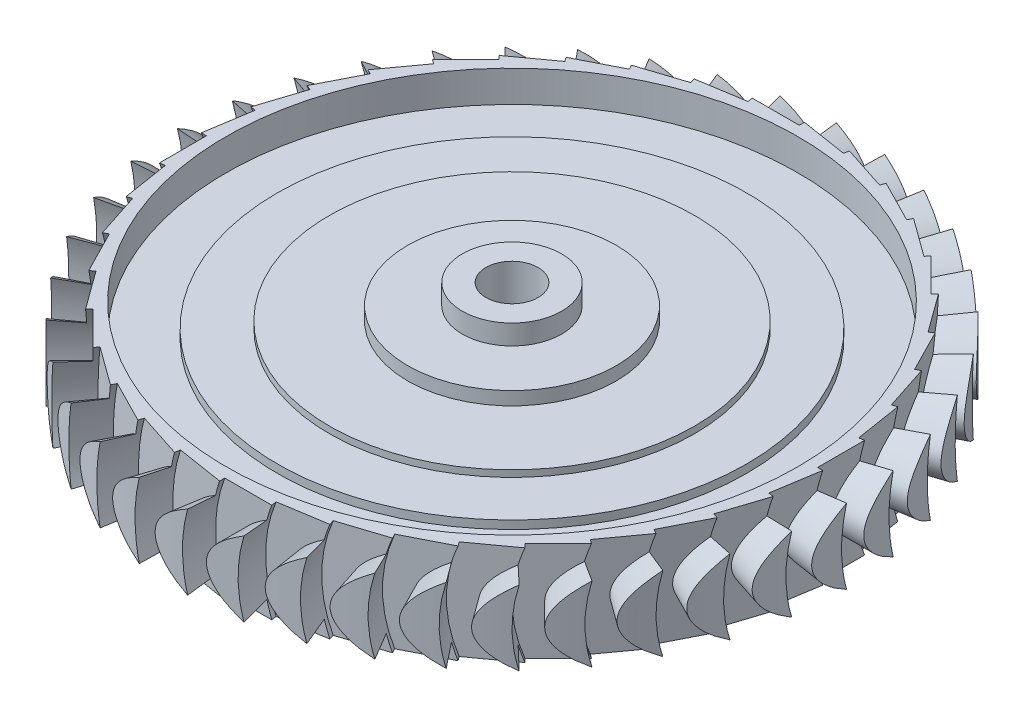
from build123d import *

# Parameters (mm, degrees)
BLADE_CUT_DEPTH   = 6.35
CIRPATTERN1_COUNT = 40


with BuildPart() as part:
    # Sketch3 → Revolve1 (revolve)
    with BuildSketch(Plane.XY):
        Polygon((63.175, -9.525), (63.175, 9.525), (56.825, 9.525), (54.825, 9.525), (54.825, 3.5), (45, 3.5), (45, 5.08), (35, 5.08), (35, 6.35), (20, 6.35), (20, 8.89), (9.525, 8.89), (9.525, 12.7), (5, 12.7), (5, -12.7), (9.525, -12.7), (9.525, -8.89), (20, -8.89), (20, -6.35), (35, -6.35), (35, -5.08), (45, -5.08), (45, -3.5), (54.825, -3.5), (54.825, -9.525), (56.825, -9.525), align=None)
    revolve(axis=Axis((0, -47.50208651, 0), (0, 1, 0)))

    # Sketch2 → Blade Cut (cut)
    with BuildSketch(Plane(origin=(63.175, 0, 0), x_dir=(0, 0, -1), z_dir=(1, 0, 0))):
        with BuildLine():
            Line((1.752461038, -9.525), (16.02605164, -9.525))
            add(Edge.make_bspline(
                [(16.02605164, 9.525), (-8.331249327, 0), (16.02605164, -9.525)],
                knots=[5.852530313, 5.852530313, 5.852530313, 6.713840301, 6.713840301, 6.713840301], degree=2, weights=[1, 0.908692507, 1]))
            Line((16.02605164, 9.525), (1.752461038, 9.525))
            ThreePointArc((1.752461038, 9.525), (0, 0), (1.752461038, -9.525))
        make_face()
    blade_cut = extrude(amount=-BLADE_CUT_DEPTH, mode=Mode.SUBTRACT)

    # CirPattern1: Blade Cut ×40 about axis
    cirpattern1_axis = Axis((0, 20.478259177, 0), (0, -1, 0))
    for i in range(1, CIRPATTERN1_COUNT):
        add(blade_cut.rotate(cirpattern1_axis, i * 360 / CIRPATTERN1_COUNT), mode=Mode.SUBTRACT)


solid = part.part
